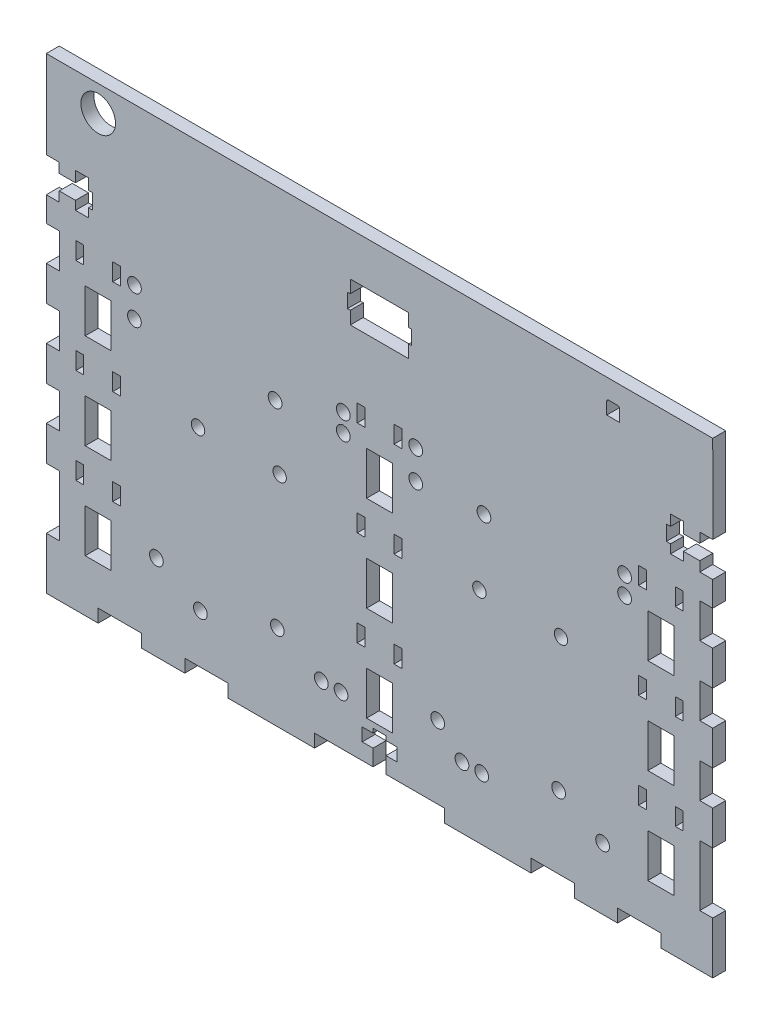
from build123d import *

# Parameters (mm, degrees)
CROQUIS1_R              = 4
CROQUIS1_R_2            = 1.5875
CROQUIS1_R_3            = 1.574835991
CROQUIS1_R_4            = 1.55
CROQUIS1_W              = 1.8
CROQUIS1_H              = 4
CROQUIS1_W_2            = 6
CROQUIS1_H_2            = 10
SALIENTE_EXTRUIR1_DEPTH = 3


with BuildPart() as part:
    # Croquis1 → Saliente-Extruir1 (new body)
    with BuildSketch(Plane.XY):
        Polygon((33723.548828016, 12976.80758014), (33720.548828016, 12976.80758014), (33720.548828016, 12968.80758014), (33723.548828016, 12968.80758014), (33723.548828016, 12960.80758014), (33720.548828016, 12960.80758014), (33720.548828016, 12952.751093946), (33720.548828016, 12952.451093946), (33720.548828016, 12946.80758014), (33723.548828016, 12946.80758014), (33723.548828016, 12934.80758014), (33711.548828016, 12934.80758014), (33711.548828016, 12937.80758014), (33701.548828016, 12937.80758014), (33701.548828016, 12934.80758014), (33691.548828016, 12934.80758014), (33691.548828016, 12937.80758014), (33681.965023012, 12937.80758014), (33681.665023012, 12937.80758014), (33681.548828016, 12937.80758014), (33681.548828016, 12934.80758014), (33661.548828016, 12934.80758014), (33661.548828016, 12937.80758014), (33648.048828016, 12937.80758014), (33648.048828016, 12941.55758014), (33650.548828016, 12941.55758014), (33650.548828016, 12944.55758014), (33648.048828016, 12944.55758014), (33648.048828016, 12945.53758014), (33645.048828016, 12945.53758014), (33645.048828016, 12944.55758014), (33642.548828016, 12944.55758014), (33642.548828016, 12941.55758014), (33645.048828016, 12941.55758014), (33645.048828016, 12937.80758014), (33631.548828016, 12937.80758014), (33631.548828016, 12934.80758014), (33611.548828016, 12934.80758014), (33611.548828016, 12937.80758014), (33601.548828016, 12937.80758014), (33601.548828016, 12934.80758014), (33591.548828016, 12934.80758014), (33591.548828016, 12937.80758014), (33581.548828016, 12937.80758014), (33581.548828016, 12934.80758014), (33569.548828016, 12934.80758014), (33569.548828016, 12946.80758014), (33572.548828016, 12946.80758014), (33572.548828016, 12960.80758014), (33569.548828016, 12960.80758014), (33569.548828016, 12968.80758014), (33572.548828016, 12968.80758014), (33572.548828016, 12976.80758014), (33569.548828016, 12976.80758014), (33569.548828016, 12984.80758014), (33572.548828016, 12984.80758014), (33572.548828016, 12992.80758014), (33569.548828016, 12992.80758014), (33569.548828016, 13000.80758014), (33572.548828016, 13000.80758014), (33572.548828016, 13008.80758014), (33569.548828016, 13008.80758014), (33569.548828016, 13014.551122571), (33572.548386751, 13014.551122571), (33572.548115163, 13016.80758014), (33576.298115163, 13016.80758014), (33576.298115163, 13014.799664078), (33579.298115163, 13014.799664078), (33579.298115163, 13016.80758014), (33580.278115163, 13016.80758014), (33580.278115163, 13020.301751126), (33579.298115163, 13020.301751126), (33579.298115163, 13022.799664078), (33576.298115163, 13022.799664078), (33576.298115163, 13020.301751126), (33572.548115163, 13020.301751126), (33572.547843617, 13022.551751126), (33569.5474024, 13022.551751126), (33569.548828016, 13042.80758014), (33723.548828016, 13042.80758014), (33723.550253631, 13022.551751126), (33720.549812414, 13022.551751126), (33720.549540868, 13020.301751126), (33716.799540868, 13020.301751126), (33716.799540868, 13022.799664078), (33713.799540868, 13022.799664078), (33713.799540868, 13020.301751126), (33712.819540868, 13020.301751126), (33712.819540868, 13016.80758014), (33713.799540868, 13016.80758014), (33713.799540868, 13014.799664078), (33716.799540868, 13014.799664078), (33716.799540868, 13016.80758014), (33720.549540868, 13016.80758014), (33720.54926928, 13014.551122571), (33723.548828016, 13014.551122571), (33723.548828016, 13008.80758014), (33720.548828016, 13008.80758014), (33720.548828016, 13000.80758014), (33723.548828016, 13000.80758014), (33723.548828016, 12992.80758014), (33720.548828016, 12992.80758014), (33720.548828016, 12984.80758014), (33723.548828016, 12984.80758014), align=None)
        with Locations((33581.548828016, 13036.80758014)):
            Circle(CROQUIS1_R, mode=Mode.SUBTRACT)
        with Locations((33594.998828016, 12954.56758014)):
            Circle(CROQUIS1_R_2, mode=Mode.SUBTRACT)
        with Locations((33605.158828016, 12949.07758014)):
            Circle(CROQUIS1_R_2, mode=Mode.SUBTRACT)
        with Locations((33622.938828016, 12954.56758014)):
            Circle(CROQUIS1_R_3, mode=Mode.SUBTRACT)
        with Locations((33633.098828016, 12949.07758014)):
            Circle(CROQUIS1_R_2, mode=Mode.SUBTRACT)
        with Locations((33637.658828016, 12949.07758014)):
            Circle(CROQUIS1_R_2, mode=Mode.SUBTRACT)
        with Locations((33604.623828016, 12985.53758014)):
            Circle(CROQUIS1_R_4, mode=Mode.SUBTRACT)
        with Locations((33623.473828016, 12985.53758014)):
            Circle(CROQUIS1_R_4, mode=Mode.SUBTRACT)
        with Locations((33589.918828016, 12999.87758014)):
            Circle(CROQUIS1_R_2, mode=Mode.SUBTRACT)
        with Locations((33589.918828016, 13006.63758014)):
            Circle(CROQUIS1_R_2, mode=Mode.SUBTRACT)
        with Locations((33622.418828016, 12999.87758014)):
            Circle(CROQUIS1_R_2, mode=Mode.SUBTRACT)
        with Locations((33638.178828016, 13005.36758014)):
            Circle(CROQUIS1_R_2, mode=Mode.SUBTRACT)
        with Locations((33638.178828016, 13001.14758014)):
            Circle(CROQUIS1_R_2, mode=Mode.SUBTRACT)
        with Locations((33659.998828016, 12954.56758014)):
            Circle(CROQUIS1_R_2, mode=Mode.SUBTRACT)
        with Locations((33665.598828016, 12949.07758014)):
            Circle(CROQUIS1_R_2, mode=Mode.SUBTRACT)
        with Locations((33670.158828016, 12949.07758014)):
            Circle(CROQUIS1_R_2, mode=Mode.SUBTRACT)
        with Locations((33669.623828016, 12985.53758014)):
            Circle(CROQUIS1_R_4, mode=Mode.SUBTRACT)
        with Locations((33654.918828016, 12999.87758014)):
            Circle(CROQUIS1_R_2, mode=Mode.SUBTRACT)
        with Locations((33654.918828016, 13006.63758014)):
            Circle(CROQUIS1_R_2, mode=Mode.SUBTRACT)
        with Locations((33670.678828016, 13001.14758014)):
            Circle(CROQUIS1_R_2, mode=Mode.SUBTRACT)
        with Locations((33688.473828016, 12985.53758014)):
            Circle(CROQUIS1_R_4, mode=Mode.SUBTRACT)
        with Locations((33687.938828016, 12954.56758014)):
            Circle(CROQUIS1_R_2, mode=Mode.SUBTRACT)
        with Locations((33698.098828016, 12949.07758014)):
            Circle(CROQUIS1_R_2, mode=Mode.SUBTRACT)
        with Locations((33703.178828016, 13005.36758014)):
            Circle(CROQUIS1_R_2, mode=Mode.SUBTRACT)
        with Locations((33703.178828016, 13001.14758014)):
            Circle(CROQUIS1_R_2, mode=Mode.SUBTRACT)
        with BuildLine():
            Line((33702.048828016, 13037.90758014), (33702.048828016, 13035.20758014))
            Line((33702.048828016, 13035.20758014), (33699.048828016, 13035.20758014))
            Line((33699.048828016, 13035.20758014), (33699.048828016, 13037.90758014))
            ThreePointArc((33699.048828016, 13037.90758014), (33699.195274625, 13038.261133531), (33699.548828016, 13038.40758014))
            Line((33699.548828016, 13038.40758014), (33701.548828016, 13038.40758014))
            ThreePointArc((33701.548828016, 13038.40758014), (33701.902381406, 13038.261133531), (33702.048828016, 13037.90758014))
        make_face(mode=Mode.SUBTRACT)
        Polygon((33639.798828016, 13032.80758014), (33653.298828016, 13032.80758014), (33653.298828016, 13029.85758014), (33653.948828016, 13029.85758014), (33653.948828016, 13026.55758014), (33653.298828016, 13026.55758014), (33653.298828016, 13023.60758014), (33639.798828016, 13023.60758014), (33639.798828016, 13026.55758014), (33639.148828016, 13026.55758014), (33639.148828016, 13029.85758014), (33639.798828016, 13029.85758014), align=None, mode=Mode.SUBTRACT)
        with Locations((33577.298828016, 13006.80758014)):
            Rectangle(CROQUIS1_W, CROQUIS1_H, mode=Mode.SUBTRACT)
        with Locations((33585.798828016, 13006.80758014)):
            Rectangle(CROQUIS1_W, CROQUIS1_H, mode=Mode.SUBTRACT)
        with Locations((33581.548828016, 12995.80758014)):
            Rectangle(CROQUIS1_W_2, CROQUIS1_H_2, mode=Mode.SUBTRACT)
        with Locations((33577.298828016, 12984.80758014)):
            Rectangle(CROQUIS1_W, CROQUIS1_H, mode=Mode.SUBTRACT)
        with Locations((33585.798828016, 12984.80758014)):
            Rectangle(CROQUIS1_W, CROQUIS1_H, mode=Mode.SUBTRACT)
        with Locations((33581.548828016, 12973.80758014)):
            Rectangle(CROQUIS1_W_2, CROQUIS1_H_2, mode=Mode.SUBTRACT)
        with Locations((33577.298828016, 12962.80758014)):
            Rectangle(CROQUIS1_W, CROQUIS1_H, mode=Mode.SUBTRACT)
        with Locations((33585.798828016, 12962.80758014)):
            Rectangle(CROQUIS1_W, CROQUIS1_H, mode=Mode.SUBTRACT)
        with Locations((33581.548828016, 12951.80758014)):
            Rectangle(CROQUIS1_W_2, CROQUIS1_H_2, mode=Mode.SUBTRACT)
        with Locations((33642.298828016, 13006.80758014)):
            Rectangle(CROQUIS1_W, CROQUIS1_H, mode=Mode.SUBTRACT)
        with Locations((33650.798828016, 13006.80758014)):
            Rectangle(CROQUIS1_W, CROQUIS1_H, mode=Mode.SUBTRACT)
        with Locations((33646.548828016, 12995.80758014)):
            Rectangle(CROQUIS1_W_2, CROQUIS1_H_2, mode=Mode.SUBTRACT)
        with Locations((33642.298828016, 12984.80758014)):
            Rectangle(CROQUIS1_W, CROQUIS1_H, mode=Mode.SUBTRACT)
        with Locations((33650.798828016, 12984.80758014)):
            Rectangle(CROQUIS1_W, CROQUIS1_H, mode=Mode.SUBTRACT)
        with Locations((33646.548828016, 12973.80758014)):
            Rectangle(CROQUIS1_W_2, CROQUIS1_H_2, mode=Mode.SUBTRACT)
        with Locations((33642.298828016, 12962.80758014)):
            Rectangle(CROQUIS1_W, CROQUIS1_H, mode=Mode.SUBTRACT)
        with Locations((33650.798828016, 12962.80758014)):
            Rectangle(CROQUIS1_W, CROQUIS1_H, mode=Mode.SUBTRACT)
        with Locations((33646.548828016, 12951.80758014)):
            Rectangle(CROQUIS1_W_2, CROQUIS1_H_2, mode=Mode.SUBTRACT)
        with Locations((33707.298828016, 13006.80758014)):
            Rectangle(CROQUIS1_W, CROQUIS1_H, mode=Mode.SUBTRACT)
        with Locations((33715.798828016, 13006.80758014)):
            Rectangle(CROQUIS1_W, CROQUIS1_H, mode=Mode.SUBTRACT)
        with Locations((33711.548828016, 12995.80758014)):
            Rectangle(CROQUIS1_W_2, CROQUIS1_H_2, mode=Mode.SUBTRACT)
        with Locations((33707.298828016, 12984.80758014)):
            Rectangle(CROQUIS1_W, CROQUIS1_H, mode=Mode.SUBTRACT)
        with Locations((33715.798828016, 12984.80758014)):
            Rectangle(CROQUIS1_W, CROQUIS1_H, mode=Mode.SUBTRACT)
        with Locations((33711.548828016, 12973.80758014)):
            Rectangle(CROQUIS1_W_2, CROQUIS1_H_2, mode=Mode.SUBTRACT)
        with Locations((33715.798828016, 12962.80758014)):
            Rectangle(CROQUIS1_W, CROQUIS1_H, mode=Mode.SUBTRACT)
        with Locations((33707.298828016, 12962.80758014)):
            Rectangle(CROQUIS1_W, CROQUIS1_H, mode=Mode.SUBTRACT)
        with Locations((33711.548828016, 12951.80758014)):
            Rectangle(CROQUIS1_W_2, CROQUIS1_H_2, mode=Mode.SUBTRACT)
    extrude(amount=SALIENTE_EXTRUIR1_DEPTH)


solid = part.part
